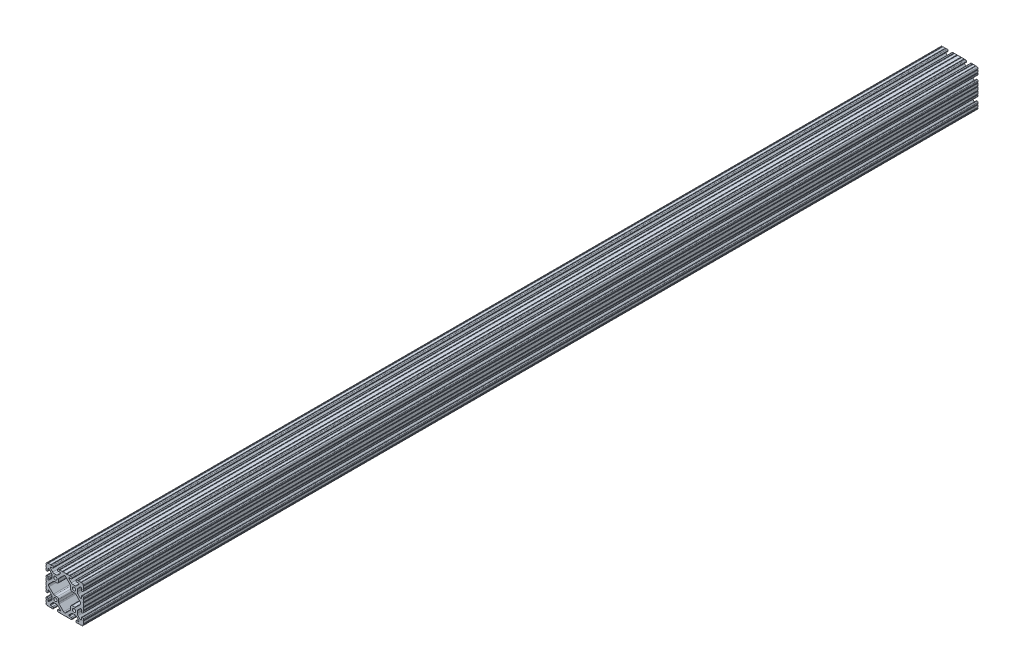
from build123d import *

# Parameters (mm, degrees)
BOSS_EXTRUDE1_DEPTH      = 914.4
BOSS_EXTRUDE1_DEPTH_BACK = 914.4
SKETCH3_R                = 3.3274


with BuildPart() as part:
    # Sketch3 → Boss-Extrude1 (new, two sides: drawn at the far end of the back side and taken through both)
    with BuildSketch(Plane.XY.offset(-BOSS_EXTRUDE1_DEPTH_BACK)):
        with BuildLine():
            Line((34.036, 28.448), (34.036, 24.630196049))
            ThreePointArc((34.036, 24.630196049), (34.497248241, 23.51664429), (35.6108, 23.055396049))
            Line((35.6108, 23.055396049), (36.525200183, 23.055396049))
            ThreePointArc((36.525200183, 23.055396049), (37.638751813, 23.516644236), (38.1, 24.630195866))
            Line((38.1, 24.630195866), (38.1, 27.023826138))
            ThreePointArc((38.1, 27.023826138), (37.117780706, 27.7845421), (38.1, 28.545258062))
            Line((38.1, 28.545258062), (38.1, 33.373016026))
            ThreePointArc((38.1, 33.373016026), (37.141472621, 34.109236774), (38.1, 34.845457521))
            ThreePointArc((38.1, 34.845457521), (37.837757813, 36.120195002), (37.086123144, 37.182631793))
            ThreePointArc((37.086123144, 37.182631793), (36.106286572, 37.843374398), (34.952681874, 38.1))
            ThreePointArc((34.952681874, 38.1), (34.190730434, 37.320215335), (33.428778994, 38.1))
            Line((33.428778994, 38.1), (28.601105935, 38.1))
            ThreePointArc((28.601105935, 38.1), (27.839158581, 37.32021942), (27.077211227, 38.1))
            Line((27.077211227, 38.1), (24.6888, 38.1))
            ThreePointArc((24.6888, 38.1), (23.575248241, 37.638751759), (23.114, 36.5252))
            Line((23.114, 36.5252), (23.114, 35.6108))
            ThreePointArc((23.114, 35.6108), (23.575248241, 34.497248241), (24.6888, 34.036))
            Line((24.6888, 34.036), (28.448, 34.036))
            ThreePointArc((28.448, 34.036), (29.076617928, 33.775617928), (29.337, 33.147))
            Line((29.337, 33.147), (29.337, 32.720693454))
            ThreePointArc((29.337, 32.720693454), (29.326675076, 32.273872751), (29.100231244, 31.888543625))
            Line((29.100231244, 31.888543625), (24.409287499, 27.197588341))
            ThreePointArc((24.409287499, 27.197588341), (22.868340045, 26.167958114), (21.050667579, 25.8064))
            Line((21.050667579, 25.8064), (17.049332421, 25.8064))
            ThreePointArc((17.049332421, 25.8064), (15.231659955, 26.167958114), (13.690712501, 27.197588341))
            Line((13.690712501, 27.197588341), (9.023381298, 31.864931024))
            ThreePointArc((9.023381298, 31.864931024), (8.830670886, 32.153343113), (8.763, 32.493548179))
            Line((8.763, 32.493548179), (8.763, 33.147))
            ThreePointArc((8.763, 33.147), (9.023382072, 33.775617928), (9.652, 34.036))
            Line((9.652, 34.036), (13.4112, 34.036))
            ThreePointArc((13.4112, 34.036), (14.524751759, 34.497248241), (14.986, 35.6108))
            Line((14.986, 35.6108), (14.986, 36.5252))
            ThreePointArc((14.986, 36.5252), (14.524751759, 37.638751759), (13.4112, 38.1))
            Line((13.4112, 38.1), (11.128867074, 38.1))
            ThreePointArc((11.128867074, 38.1), (10.367071033, 37.320370693), (9.605274992, 38.1))
            Line((9.605274992, 38.1), (4.777313069, 38.1))
            ThreePointArc((4.777313069, 38.1), (4.015517029, 37.320370693), (3.253720988, 38.1))
            Line((3.253720988, 38.1), (-3.253720988, 38.1))
            ThreePointArc((-3.253720988, 38.1), (-4.015517029, 37.320370693), (-4.777313069, 38.1))
            Line((-4.777313069, 38.1), (-9.605274992, 38.1))
            ThreePointArc((-9.605274992, 38.1), (-10.367071033, 37.320370693), (-11.128867074, 38.1))
            Line((-11.128867074, 38.1), (-13.4112, 38.1))
            ThreePointArc((-13.4112, 38.1), (-14.524751759, 37.638751759), (-14.986, 36.5252))
            Line((-14.986, 36.5252), (-14.986, 35.6108))
            ThreePointArc((-14.986, 35.6108), (-14.524751759, 34.497248241), (-13.4112, 34.036))
            Line((-13.4112, 34.036), (-9.652, 34.036))
            ThreePointArc((-9.652, 34.036), (-9.023382072, 33.775617928), (-8.763, 33.147))
            Line((-8.763, 33.147), (-8.763, 32.493548179))
            ThreePointArc((-8.763, 32.493548179), (-8.830670886, 32.153343113), (-9.023381298, 31.864931024))
            Line((-9.023381298, 31.864931024), (-13.690712501, 27.197588341))
            ThreePointArc((-13.690712501, 27.197588341), (-15.231659955, 26.167958114), (-17.049332421, 25.8064))
            Line((-17.049332421, 25.8064), (-21.050667579, 25.8064))
            ThreePointArc((-21.050667579, 25.8064), (-22.868340045, 26.167958114), (-24.409287499, 27.197588341))
            Line((-24.409287499, 27.197588341), (-29.100231244, 31.888543625))
            ThreePointArc((-29.100231244, 31.888543625), (-29.326675076, 32.273872751), (-29.337, 32.720693454))
            Line((-29.337, 32.720693454), (-29.337, 33.147))
            ThreePointArc((-29.337, 33.147), (-29.076617928, 33.775617928), (-28.448, 34.036))
            Line((-28.448, 34.036), (-24.6888, 34.036))
            ThreePointArc((-24.6888, 34.036), (-23.575248241, 34.497248241), (-23.114, 35.6108))
            Line((-23.114, 35.6108), (-23.114, 36.5252))
            ThreePointArc((-23.114, 36.5252), (-23.575248241, 37.638751759), (-24.6888, 38.1))
            Line((-24.6888, 38.1), (-27.077211227, 38.1))
            ThreePointArc((-27.077211227, 38.1), (-27.839158581, 37.32021942), (-28.601105935, 38.1))
            Line((-28.601105935, 38.1), (-33.428778994, 38.1))
            ThreePointArc((-33.428778994, 38.1), (-34.190730434, 37.320215335), (-34.952681874, 38.1))
            ThreePointArc((-34.952681874, 38.1), (-36.106286572, 37.843374398), (-37.086123144, 37.182631793))
            ThreePointArc((-37.086123144, 37.182631793), (-37.837757813, 36.120195002), (-38.1, 34.845457521))
            ThreePointArc((-38.1, 34.845457521), (-37.141472621, 34.109236774), (-38.1, 33.373016026))
            Line((-38.1, 33.373016026), (-38.1, 28.545258062))
            ThreePointArc((-38.1, 28.545258062), (-37.117780706, 27.7845421), (-38.1, 27.023826138))
            Line((-38.1, 27.023826138), (-38.1, 24.630195866))
            ThreePointArc((-38.1, 24.630195866), (-37.638751813, 23.516644236), (-36.525200183, 23.055396049))
            Line((-36.525200183, 23.055396049), (-35.6108, 23.055396049))
            ThreePointArc((-35.6108, 23.055396049), (-34.497248241, 23.51664429), (-34.036, 24.630196049))
            Line((-34.036, 24.630196049), (-34.036, 28.448))
            ThreePointArc((-34.036, 28.448), (-33.775617928, 29.076617928), (-33.147, 29.337))
            Line((-33.147, 29.337), (-32.664287242, 29.337))
            ThreePointArc((-32.664287242, 29.337), (-32.324081166, 29.269328695), (-32.03566854, 29.076617155))
            Line((-32.03566854, 29.076617155), (-27.19758008, 24.238516795))
            ThreePointArc((-27.19758008, 24.238516795), (-26.167955879, 22.697572205), (-25.8064, 20.879905136))
            Line((-25.8064, 20.879905136), (-25.8064, 17.220094864))
            ThreePointArc((-25.8064, 17.220094864), (-26.167955879, 15.402427795), (-27.19758008, 13.861483205))
            Line((-27.19758008, 13.861483205), (-31.948944541, 9.110107057))
            ThreePointArc((-31.948944541, 9.110107057), (-32.333417096, 8.853210196), (-32.786933649, 8.763))
            Line((-32.786933649, 8.763), (-33.060275787, 8.763))
            ThreePointArc((-33.060275787, 8.763), (-33.750216995, 9.048783005), (-34.036, 9.738724213))
            Line((-34.036, 9.738724213), (-34.036, 13.469803585))
            ThreePointArc((-34.036, 13.469803585), (-34.497248348, 14.583355603), (-35.610800366, 15.044603951))
            Line((-35.610800366, 15.044603951), (-36.5252, 15.044603951))
            ThreePointArc((-36.5252, 15.044603951), (-37.638751759, 14.58335571), (-38.1, 13.469803951))
            Line((-38.1, 13.469803951), (-38.1, 11.075039289))
            ThreePointArc((-38.1, 11.075039289), (-37.117000248, 10.313517272), (-38.1, 9.551995255))
            Line((-38.1, 9.551995255), (-38.1, 4.723759308))
            ThreePointArc((-38.1, 4.723759308), (-37.117000248, 3.962237292), (-38.1, 3.200715275))
            Line((-38.1, 3.200715275), (-38.1, -3.200715275))
            ThreePointArc((-38.1, -3.200715275), (-37.117000248, -3.962237292), (-38.1, -4.723759308))
            Line((-38.1, -4.723759308), (-38.1, -9.551995255))
            ThreePointArc((-38.1, -9.551995255), (-37.117000248, -10.313517272), (-38.1, -11.075039289))
            Line((-38.1, -11.075039289), (-38.1, -13.469803951))
            ThreePointArc((-38.1, -13.469803951), (-37.638751759, -14.58335571), (-36.5252, -15.044603951))
            Line((-36.5252, -15.044603951), (-35.610800366, -15.044603951))
            ThreePointArc((-35.610800366, -15.044603951), (-34.497248348, -14.583355603), (-34.036, -13.469803585))
            Line((-34.036, -13.469803585), (-34.036, -9.738724213))
            ThreePointArc((-34.036, -9.738724213), (-33.750216995, -9.048783005), (-33.060275787, -8.763))
            Line((-33.060275787, -8.763), (-32.786933649, -8.763))
            ThreePointArc((-32.786933649, -8.763), (-32.333417096, -8.853210196), (-31.948944541, -9.110107057))
            Line((-31.948944541, -9.110107057), (-27.19758008, -13.861483205))
            ThreePointArc((-27.19758008, -13.861483205), (-26.167955879, -15.402427795), (-25.8064, -17.220094864))
            Line((-25.8064, -17.220094864), (-25.8064, -20.879905136))
            ThreePointArc((-25.8064, -20.879905136), (-26.167955879, -22.697572205), (-27.19758008, -24.238516795))
            Line((-27.19758008, -24.238516795), (-32.03566854, -29.076617155))
            ThreePointArc((-32.03566854, -29.076617155), (-32.324081166, -29.269328695), (-32.664287242, -29.337))
            Line((-32.664287242, -29.337), (-33.147, -29.337))
            ThreePointArc((-33.147, -29.337), (-33.775617928, -29.076617928), (-34.036, -28.448))
            Line((-34.036, -28.448), (-34.036, -24.630196049))
            ThreePointArc((-34.036, -24.630196049), (-34.497248241, -23.51664429), (-35.6108, -23.055396049))
            Line((-35.6108, -23.055396049), (-36.525200183, -23.055396049))
            ThreePointArc((-36.525200183, -23.055396049), (-37.638751813, -23.516644236), (-38.1, -24.630195866))
            Line((-38.1, -24.630195866), (-38.1, -27.023826138))
            ThreePointArc((-38.1, -27.023826138), (-37.117780706, -27.7845421), (-38.1, -28.545258062))
            Line((-38.1, -28.545258062), (-38.1, -33.373016026))
            ThreePointArc((-38.1, -33.373016026), (-37.141472621, -34.109236774), (-38.1, -34.845457521))
            ThreePointArc((-38.1, -34.845457521), (-37.837757813, -36.120195002), (-37.086123144, -37.182631793))
            ThreePointArc((-37.086123144, -37.182631793), (-36.106286572, -37.843374398), (-34.952681874, -38.1))
            ThreePointArc((-34.952681874, -38.1), (-34.190730434, -37.320215335), (-33.428778994, -38.1))
            Line((-33.428778994, -38.1), (-28.601105935, -38.1))
            ThreePointArc((-28.601105935, -38.1), (-27.839158581, -37.32021942), (-27.077211227, -38.1))
            Line((-27.077211227, -38.1), (-24.6888, -38.1))
            ThreePointArc((-24.6888, -38.1), (-23.575248241, -37.638751759), (-23.114, -36.5252))
            Line((-23.114, -36.5252), (-23.114, -35.6108))
            ThreePointArc((-23.114, -35.6108), (-23.575248241, -34.497248241), (-24.6888, -34.036))
            Line((-24.6888, -34.036), (-28.448, -34.036))
            ThreePointArc((-28.448, -34.036), (-29.076617928, -33.775617928), (-29.337, -33.147))
            Line((-29.337, -33.147), (-29.337, -32.720693454))
            ThreePointArc((-29.337, -32.720693454), (-29.326675076, -32.273872751), (-29.100231244, -31.888543625))
            Line((-29.100231244, -31.888543625), (-24.409287499, -27.197588341))
            ThreePointArc((-24.409287499, -27.197588341), (-22.868340045, -26.167958114), (-21.050667579, -25.8064))
            Line((-21.050667579, -25.8064), (-17.049332421, -25.8064))
            ThreePointArc((-17.049332421, -25.8064), (-15.231659955, -26.167958114), (-13.690712501, -27.197588341))
            Line((-13.690712501, -27.197588341), (-9.023381298, -31.864931024))
            ThreePointArc((-9.023381298, -31.864931024), (-8.830670886, -32.153343113), (-8.763, -32.493548179))
            Line((-8.763, -32.493548179), (-8.763, -33.147))
            ThreePointArc((-8.763, -33.147), (-9.023382072, -33.775617928), (-9.652, -34.036))
            Line((-9.652, -34.036), (-13.4112, -34.036))
            ThreePointArc((-13.4112, -34.036), (-14.524751759, -34.497248241), (-14.986, -35.6108))
            Line((-14.986, -35.6108), (-14.986, -36.5252))
            ThreePointArc((-14.986, -36.5252), (-14.524751759, -37.638751759), (-13.4112, -38.1))
            Line((-13.4112, -38.1), (-11.128867074, -38.1))
            ThreePointArc((-11.128867074, -38.1), (-10.367071033, -37.320370693), (-9.605274992, -38.1))
            Line((-9.605274992, -38.1), (-4.777313069, -38.1))
            ThreePointArc((-4.777313069, -38.1), (-4.015517029, -37.320370693), (-3.253720988, -38.1))
            Line((-3.253720988, -38.1), (3.253720988, -38.1))
            ThreePointArc((3.253720988, -38.1), (4.015517029, -37.320370693), (4.777313069, -38.1))
            Line((4.777313069, -38.1), (9.605274992, -38.1))
            ThreePointArc((9.605274992, -38.1), (10.367071033, -37.320370693), (11.128867074, -38.1))
            Line((11.128867074, -38.1), (13.4112, -38.1))
            ThreePointArc((13.4112, -38.1), (14.524751759, -37.638751759), (14.986, -36.5252))
            Line((14.986, -36.5252), (14.986, -35.6108))
            ThreePointArc((14.986, -35.6108), (14.524751759, -34.497248241), (13.4112, -34.036))
            Line((13.4112, -34.036), (9.652, -34.036))
            ThreePointArc((9.652, -34.036), (9.023382072, -33.775617928), (8.763, -33.147))
            Line((8.763, -33.147), (8.763, -32.493548179))
            ThreePointArc((8.763, -32.493548179), (8.830670886, -32.153343113), (9.023381298, -31.864931024))
            Line((9.023381298, -31.864931024), (13.690712501, -27.197588341))
            ThreePointArc((13.690712501, -27.197588341), (15.231659955, -26.167958114), (17.049332421, -25.8064))
            Line((17.049332421, -25.8064), (21.050667579, -25.8064))
            ThreePointArc((21.050667579, -25.8064), (22.868340045, -26.167958114), (24.409287499, -27.197588341))
            Line((24.409287499, -27.197588341), (29.100231244, -31.888543625))
            ThreePointArc((29.100231244, -31.888543625), (29.326675076, -32.273872751), (29.337, -32.720693454))
            Line((29.337, -32.720693454), (29.337, -33.147))
            ThreePointArc((29.337, -33.147), (29.076617928, -33.775617928), (28.448, -34.036))
            Line((28.448, -34.036), (24.6888, -34.036))
            ThreePointArc((24.6888, -34.036), (23.575248241, -34.497248241), (23.114, -35.6108))
            Line((23.114, -35.6108), (23.114, -36.5252))
            ThreePointArc((23.114, -36.5252), (23.575248241, -37.638751759), (24.6888, -38.1))
            Line((24.6888, -38.1), (27.077211227, -38.1))
            ThreePointArc((27.077211227, -38.1), (27.839158581, -37.32021942), (28.601105935, -38.1))
            Line((28.601105935, -38.1), (33.428778994, -38.1))
            ThreePointArc((33.428778994, -38.1), (34.190730434, -37.320215335), (34.952681874, -38.1))
            ThreePointArc((34.952681874, -38.1), (36.106286572, -37.843374398), (37.086123144, -37.182631793))
            ThreePointArc((37.086123144, -37.182631793), (37.837757813, -36.120195002), (38.1, -34.845457521))
            ThreePointArc((38.1, -34.845457521), (37.141472621, -34.109236774), (38.1, -33.373016026))
            Line((38.1, -33.373016026), (38.1, -28.545258062))
            ThreePointArc((38.1, -28.545258062), (37.117780706, -27.7845421), (38.1, -27.023826138))
            Line((38.1, -27.023826138), (38.1, -24.630195866))
            ThreePointArc((38.1, -24.630195866), (37.638751813, -23.516644236), (36.525200183, -23.055396049))
            Line((36.525200183, -23.055396049), (35.6108, -23.055396049))
            ThreePointArc((35.6108, -23.055396049), (34.497248241, -23.51664429), (34.036, -24.630196049))
            Line((34.036, -24.630196049), (34.036, -28.448))
            ThreePointArc((34.036, -28.448), (33.775617928, -29.076617928), (33.147, -29.337))
            Line((33.147, -29.337), (32.664287242, -29.337))
            ThreePointArc((32.664287242, -29.337), (32.324081166, -29.269328695), (32.03566854, -29.076617155))
            Line((32.03566854, -29.076617155), (27.19758008, -24.238516795))
            ThreePointArc((27.19758008, -24.238516795), (26.167955879, -22.697572205), (25.8064, -20.879905136))
            Line((25.8064, -20.879905136), (25.8064, -17.220094864))
            ThreePointArc((25.8064, -17.220094864), (26.167955879, -15.402427795), (27.19758008, -13.861483205))
            Line((27.19758008, -13.861483205), (31.948944541, -9.110107057))
            ThreePointArc((31.948944541, -9.110107057), (32.333417096, -8.853210196), (32.786933649, -8.763))
            Line((32.786933649, -8.763), (33.060275787, -8.763))
            ThreePointArc((33.060275787, -8.763), (33.750216995, -9.048783005), (34.036, -9.738724213))
            Line((34.036, -9.738724213), (34.036, -13.469803585))
            ThreePointArc((34.036, -13.469803585), (34.497248348, -14.583355603), (35.610800366, -15.044603951))
            Line((35.610800366, -15.044603951), (36.5252, -15.044603951))
            ThreePointArc((36.5252, -15.044603951), (37.638751759, -14.58335571), (38.1, -13.469803951))
            Line((38.1, -13.469803951), (38.1, -11.075039289))
            ThreePointArc((38.1, -11.075039289), (37.117000248, -10.313517272), (38.1, -9.551995255))
            Line((38.1, -9.551995255), (38.1, -4.723759308))
            ThreePointArc((38.1, -4.723759308), (37.117000248, -3.962237292), (38.1, -3.200715275))
            Line((38.1, -3.200715275), (38.1, 3.200715275))
            ThreePointArc((38.1, 3.200715275), (37.117000248, 3.962237292), (38.1, 4.723759308))
            Line((38.1, 4.723759308), (38.1, 9.551995255))
            ThreePointArc((38.1, 9.551995255), (37.117000248, 10.313517272), (38.1, 11.075039289))
            Line((38.1, 11.075039289), (38.1, 13.469803951))
            ThreePointArc((38.1, 13.469803951), (37.638751759, 14.58335571), (36.5252, 15.044603951))
            Line((36.5252, 15.044603951), (35.610800366, 15.044603951))
            ThreePointArc((35.610800366, 15.044603951), (34.497248348, 14.583355603), (34.036, 13.469803585))
            Line((34.036, 13.469803585), (34.036, 9.738724213))
            ThreePointArc((34.036, 9.738724213), (33.750216995, 9.048783005), (33.060275787, 8.763))
            Line((33.060275787, 8.763), (32.786933649, 8.763))
            ThreePointArc((32.786933649, 8.763), (32.333417096, 8.853210196), (31.948944541, 9.110107057))
            Line((31.948944541, 9.110107057), (27.19758008, 13.861483205))
            ThreePointArc((27.19758008, 13.861483205), (26.167955879, 15.402427795), (25.8064, 17.220094864))
            Line((25.8064, 17.220094864), (25.8064, 20.879905136))
            ThreePointArc((25.8064, 20.879905136), (26.167955879, 22.697572205), (27.19758008, 24.238516795))
            Line((27.19758008, 24.238516795), (32.03566854, 29.076617155))
            ThreePointArc((32.03566854, 29.076617155), (32.324081166, 29.269328695), (32.664287242, 29.337))
            Line((32.664287242, 29.337), (33.147, 29.337))
            ThreePointArc((33.147, 29.337), (33.775617928, 29.076617928), (34.036, 28.448))
        make_face()
        with Locations((19.05, 19.05)):
            Circle(SKETCH3_R, mode=Mode.SUBTRACT)
        with Locations((-19.05, 19.05)):
            Circle(SKETCH3_R, mode=Mode.SUBTRACT)
        with Locations((19.05, -19.05)):
            Circle(SKETCH3_R, mode=Mode.SUBTRACT)
        with Locations((-19.05, -19.05)):
            Circle(SKETCH3_R, mode=Mode.SUBTRACT)
        with BuildLine():
            Line((-11.363666791, -22.843321003), (-2.051515952, -32.155494748))
            ThreePointArc((-2.051515952, -32.155494748), (-1.11031328, -32.786013752), (0, -33.011005091))
            ThreePointArc((0, -33.011005091), (1.11031328, -32.786013752), (2.051515952, -32.155494748))
            Line((2.051515952, -32.155494748), (11.363666791, -22.843321003))
            ThreePointArc((11.363666791, -22.843321003), (12.051918263, -21.813277828), (12.2936, -20.598259734))
            Line((12.2936, -20.598259734), (12.2936, -15.4686))
            ThreePointArc((12.2936, -15.4686), (13.22353597, -13.22353597), (15.4686, -12.2936))
            Line((15.4686, -12.2936), (20.769026744, -12.2936))
            ThreePointArc((20.769026744, -12.2936), (21.984048446, -12.051916769), (23.014093535, -11.363661269))
            Line((23.014093535, -11.363661269), (31.902125566, -2.475607377))
            ThreePointArc((31.902125566, -2.475607377), (32.607298578, -1.335259481), (32.728725173, 0))
            ThreePointArc((32.728725173, 0), (32.607298578, 1.335259481), (31.902125566, 2.475607377))
            Line((31.902125566, 2.475607377), (23.014093535, 11.363661269))
            ThreePointArc((23.014093535, 11.363661269), (21.984048446, 12.051916769), (20.769026744, 12.2936))
            Line((20.769026744, 12.2936), (15.4686, 12.2936))
            ThreePointArc((15.4686, 12.2936), (13.22353597, 13.22353597), (12.2936, 15.4686))
            Line((12.2936, 15.4686), (12.2936, 20.598259734))
            ThreePointArc((12.2936, 20.598259734), (12.051918263, 21.813277828), (11.363666791, 22.843321003))
            Line((11.363666791, 22.843321003), (2.051515952, 32.155494748))
            ThreePointArc((2.051515952, 32.155494748), (1.11031328, 32.786013752), (0, 33.011005091))
            ThreePointArc((0, 33.011005091), (-1.11031328, 32.786013752), (-2.051515952, 32.155494748))
            Line((-2.051515952, 32.155494748), (-11.363666791, 22.843321003))
            ThreePointArc((-11.363666791, 22.843321003), (-12.051918263, 21.813277828), (-12.2936, 20.598259734))
            Line((-12.2936, 20.598259734), (-12.2936, 15.4686))
            ThreePointArc((-12.2936, 15.4686), (-13.22353597, 13.22353597), (-15.4686, 12.2936))
            Line((-15.4686, 12.2936), (-20.769026744, 12.2936))
            ThreePointArc((-20.769026744, 12.2936), (-21.984048446, 12.051916769), (-23.014093535, 11.363661269))
            Line((-23.014093535, 11.363661269), (-31.902125566, 2.475607377))
            ThreePointArc((-31.902125566, 2.475607377), (-32.607298578, 1.335259481), (-32.728725173, 0))
            ThreePointArc((-32.728725173, 0), (-32.607298578, -1.335259481), (-31.902125566, -2.475607377))
            Line((-31.902125566, -2.475607377), (-23.014093535, -11.363661269))
            ThreePointArc((-23.014093535, -11.363661269), (-21.984048446, -12.051916769), (-20.769026744, -12.2936))
            Line((-20.769026744, -12.2936), (-15.4686, -12.2936))
            ThreePointArc((-15.4686, -12.2936), (-13.22353597, -13.22353597), (-12.2936, -15.4686))
            Line((-12.2936, -15.4686), (-12.2936, -20.598259734))
            ThreePointArc((-12.2936, -20.598259734), (-12.051918263, -21.813277828), (-11.363666791, -22.843321003))
        make_face(mode=Mode.SUBTRACT)
    extrude(amount=BOSS_EXTRUDE1_DEPTH + BOSS_EXTRUDE1_DEPTH_BACK)


solid = part.part
